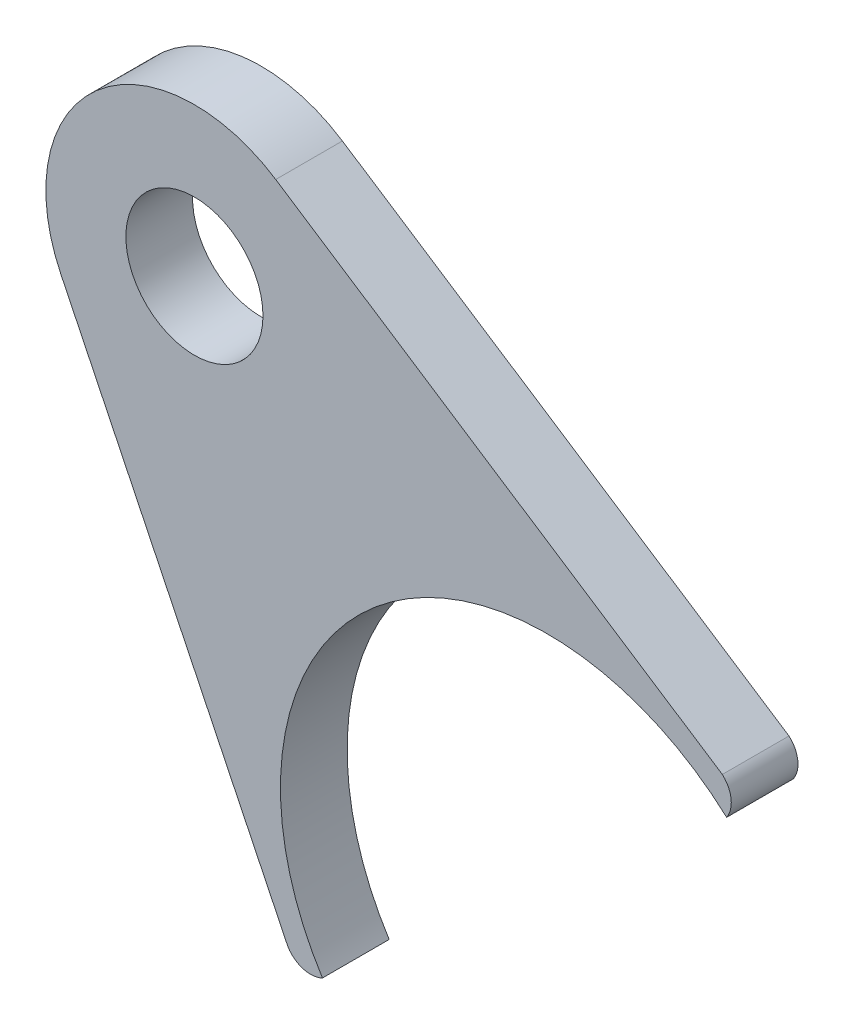
from build123d import *

# Parameters (mm, degrees)
SKETCH1_R           = 3.2639
BOSS_EXTRUDE1_DEPTH = 3.175


with BuildPart() as part:
    # Sketch1 → Boss-Extrude1 (new body)
    with BuildSketch(Plane.XY):
        with BuildLine():
            Line((8.332830832, 11.070028457), (-12.929640508, 24.970840039))
            ThreePointArc((-12.929640508, 24.970840039), (-21.472198622, 24.361825277), (-23.167247023, 15.967004908))
            Line((-23.167247023, 15.967004908), (-12.346529081, -6.378975662))
            ThreePointArc((-12.346529081, -6.378975662), (-11.614913033, -6.927316414), (-10.704589931, -6.842160847))
            ThreePointArc((-10.704589931, -6.842160847), (-8.195530473, 9.707558442), (8.540577231, 9.405421373))
            ThreePointArc((8.540577231, 9.405421373), (8.750653716, 10.276906483), (8.332830832, 11.070028457))
        make_face()
        with Locations((-16.800520825, 19.049999999)):
            Circle(SKETCH1_R, mode=Mode.SUBTRACT)
    extrude(amount=BOSS_EXTRUDE1_DEPTH)


solid = part.part
